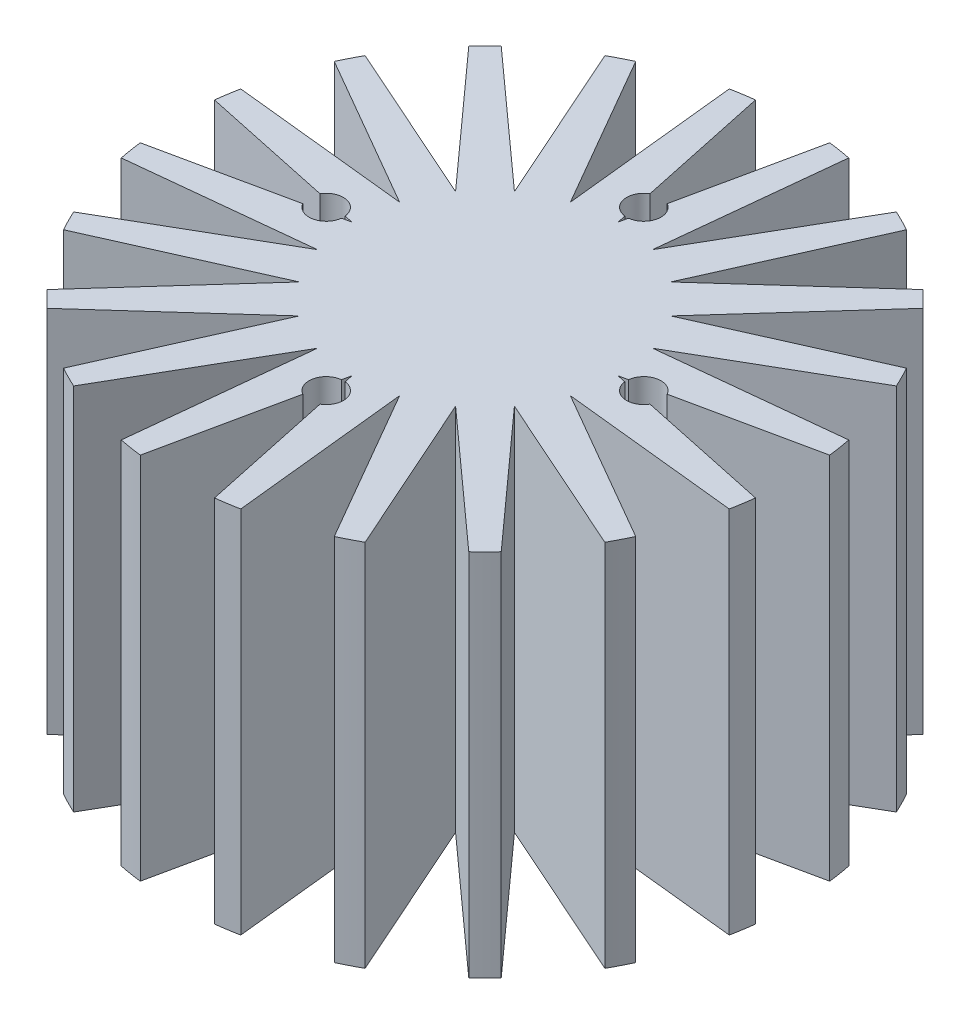
from build123d import *

# Parameters (mm, degrees)
SKETCH1_R           = 18.05
BOSS_EXTRUDE1_DEPTH = 21.5
SKETCH2_R           = 1
CUT_EXTRUDE1_DEPTH  = 34.374466288
CUT_EXTRUDE2_DEPTH  = 34.374466288
CIRPATTERN1_COUNT   = 20


with BuildPart() as part:
    # Sketch1 → Boss-Extrude1 (new body)
    with BuildSketch(Plane(origin=(0, 0, 0), x_dir=(1, 0, 0), z_dir=(0, 1, 0))):
        with Locations(Location((0, 0, 0), (0, 0, 270))):
            Circle(SKETCH1_R)
    extrude(amount=BOSS_EXTRUDE1_DEPTH)

    # Sketch2 → Cut-Extrude1 (cut, through all)
    with BuildSketch(Plane(origin=(0, 21.5, 0), x_dir=(1, 0, 0), z_dir=(0, 1, 0))):
        with Locations(Location((-9.25, 0, 0), (0, 0, 270))):
            Circle(SKETCH2_R)
        with Locations(Location((0, 9.25, 0), (0, 0, 270))):
            Circle(SKETCH2_R)
        with Locations(Location((9.25, 0, 0), (0, 0, 270))):
            Circle(SKETCH2_R)
        with Locations(Location((0, -9.25, 0), (0, 0, 270))):
            Circle(SKETCH2_R)
    extrude(amount=-CUT_EXTRUDE1_DEPTH, mode=Mode.SUBTRACT)

    # Sketch3 → Cut-Extrude2 (cut, through all)
    with BuildSketch(Plane(origin=(0, 21.5, 0), x_dir=(1, 0, 0), z_dir=(0, 1, 0))):
        with BuildLine():
            ThreePointArc((2.161718459, 17.92008575), (0, 18.05), (-2.161718459, 17.92008575))
            Line((-2.161718459, 17.92008575), (-0.502594701, 10.114522161))
            ThreePointArc((-0.502594701, 10.114522161), (0, 10.25), (0.502594701, 10.114522161))
            Line((0.502594701, 10.114522161), (2.161718459, 17.92008575))
        make_face()
        with BuildLine():
            ThreePointArc((0.502594701, 10.114522161), (0, 10.25), (-0.502594701, 10.114522161))
            Line((-0.502594701, 10.114522161), (-0.107510264, 8.255796025))
            ThreePointArc((-0.107510264, 8.255796025), (0, 8.25), (0.107510264, 8.255796025))
            Line((0.107510264, 8.255796025), (0.502594701, 10.114522161))
        make_face()
        with BuildLine():
            ThreePointArc((0.107510264, 8.255796025), (0, 8.25), (-0.107510264, 8.255796025))
            Line((-0.107510264, 8.255796025), (0, 7.75))
            Line((0, 7.75), (0.107510264, 8.255796025))
        make_face()
    cut_extrude2 = extrude(amount=-CUT_EXTRUDE2_DEPTH, mode=Mode.SUBTRACT)

    # CirPattern1: Cut-Extrude2 ×20 about axis
    cirpattern1_axis = Axis((0, 0, 0), (0, 1, 0))
    for i in range(1, CIRPATTERN1_COUNT):
        add(cut_extrude2.rotate(cirpattern1_axis, i * 360 / CIRPATTERN1_COUNT), mode=Mode.SUBTRACT)


solid = part.part
